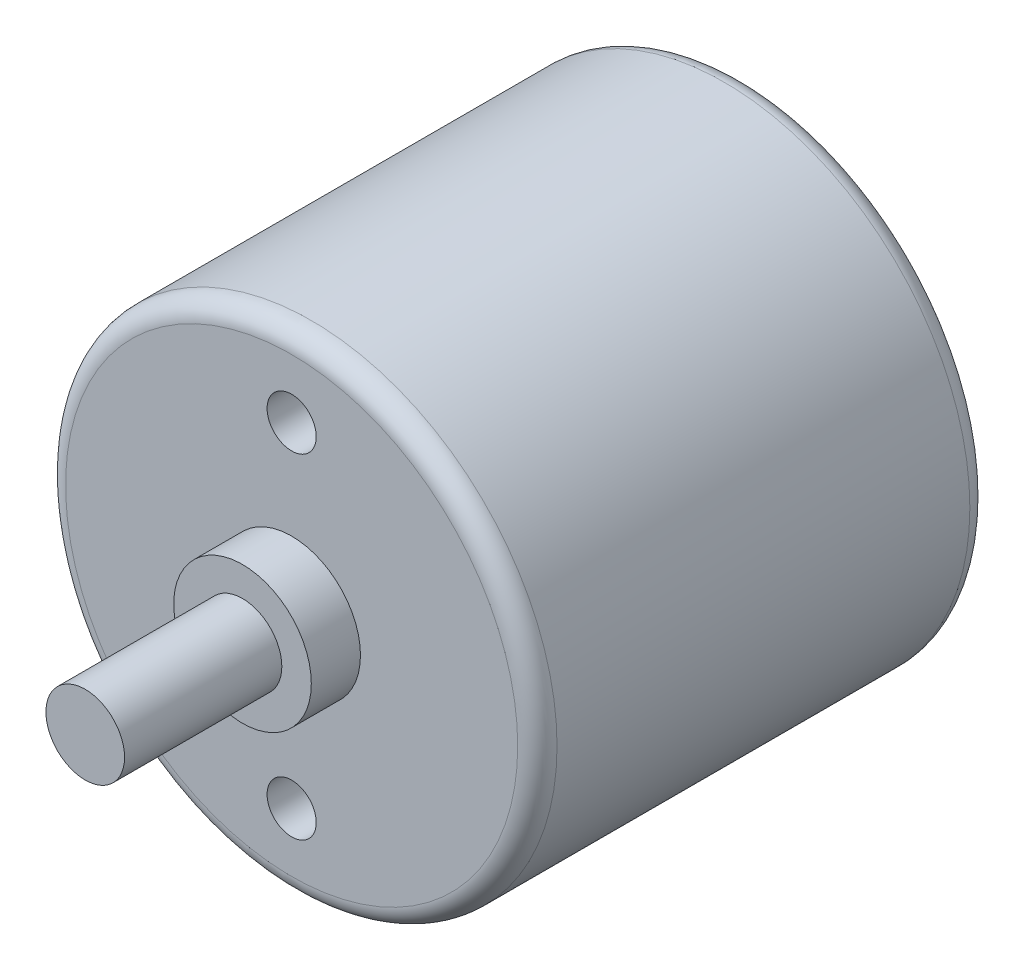
from build123d import *

# Parameters (mm, degrees)
ESBO_O1_R                = 12.5
RESSALTO_EXTRUS_O1_DEPTH = 23
ESBO_O2_R                = 3.5
RESSALTO_EXTRUS_O2_DEPTH = 2.5
FILETE1_R                = 1
ESBO_O3_R                = 2
RESSALTO_EXTRUS_O3_DEPTH = 8
ESBO_O4_R                = 1.25
CORTE_EXTRUS_O1_DEPTH    = 10


with BuildPart() as part:
    # Esboço1 → Ressalto-extrusão1 (new body)
    with BuildSketch(Plane.XY):
        Circle(ESBO_O1_R)
    extrude(amount=RESSALTO_EXTRUS_O1_DEPTH)

    # Esboço2 → Ressalto-extrusão2 (add)
    with BuildSketch(Plane.XY.offset(23)):
        Circle(ESBO_O2_R)
    extrude(amount=RESSALTO_EXTRUS_O2_DEPTH)

    # Filete1
    filete1_edges = [part.edges().sort_by_distance(p)[0] for p in [
        (-12.5, 0, 0),
        (-12.5, 0, 23),
    ]]
    fillet(filete1_edges, radius=FILETE1_R)

    # Esboço3 → Ressalto-extrusão3 (add)
    with BuildSketch(Plane.XY.offset(25.5)):
        Circle(ESBO_O3_R)
    extrude(amount=RESSALTO_EXTRUS_O3_DEPTH)

    # Esboço4 → Corte-extrusão1 (cut)
    with BuildSketch(Plane.XY.offset(23)):
        with Locations((0, 8.5)):
            Circle(ESBO_O4_R)
        with Locations((0, -8.5)):
            Circle(ESBO_O4_R)
    extrude(amount=-CORTE_EXTRUS_O1_DEPTH, mode=Mode.SUBTRACT)


solid = part.part
